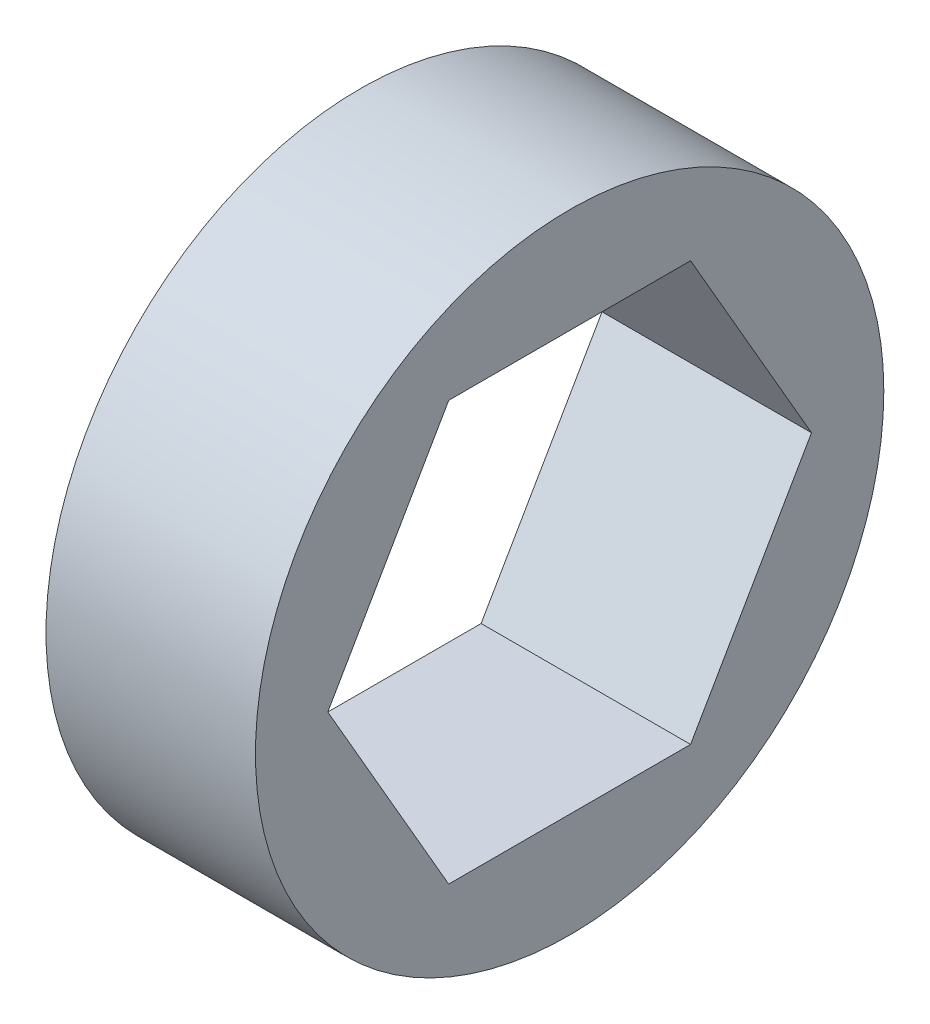
from build123d import *

# Parameters (mm, degrees)
SKETCH1_R           = 9.525
BOSS_EXTRUDE1_DEPTH = 6.35


with BuildPart() as part:
    # Sketch1 → Boss-Extrude1 (new body)
    with BuildSketch(Plane(origin=(0, 0, 0), x_dir=(0, 0, -1), z_dir=(1, 0, 0))):
        Circle(SKETCH1_R)
        Polygon((3.666174209, 6.35), (-3.666174209, 6.35), (-7.332348419, 0), (-3.666174209, -6.35), (3.666174209, -6.35), (7.332348419, 0), align=None, mode=Mode.SUBTRACT)
    extrude(amount=BOSS_EXTRUDE1_DEPTH)


solid = part.part
